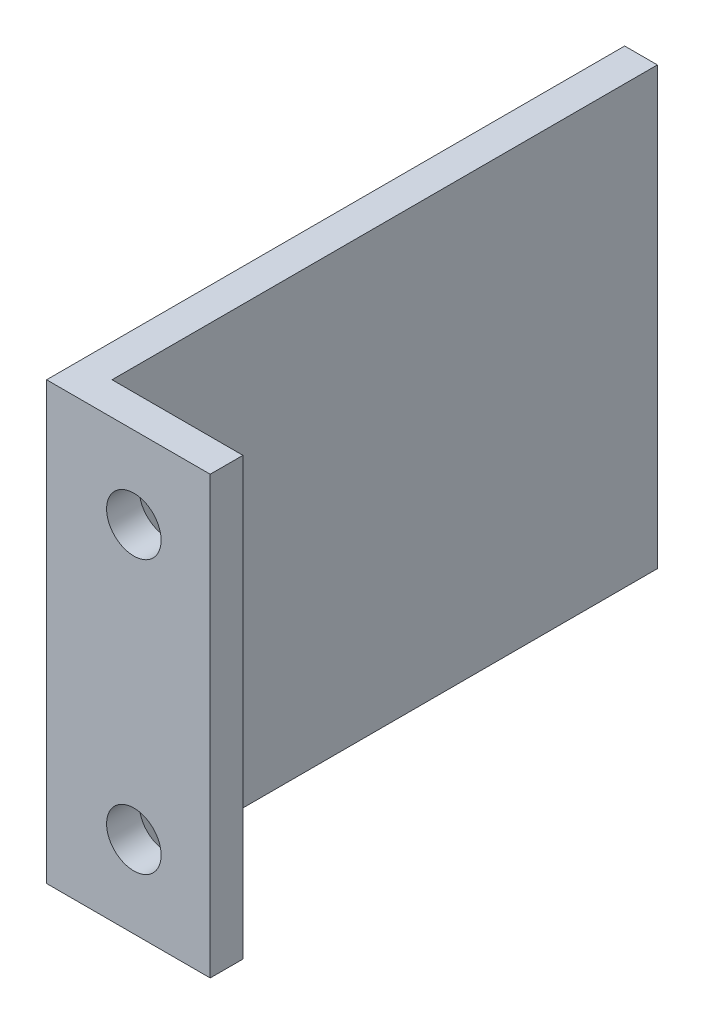
from build123d import *

# Parameters (mm, degrees)
SKETCH1_W           = 15
SKETCH1_H           = 40
BOSS_EXTRUDE1_DEPTH = 3
SKETCH2_W           = 3
SKETCH2_H           = 40
BOSS_EXTRUDE2_DEPTH = 50
SKETCH3_R           = 2.5
CUT_EXTRUDE1_DEPTH  = 3
LPATTERN1_COUNT     = 2
LPATTERN1_PITCH     = 25


with BuildPart() as part:
    # Sketch1 → Boss-Extrude1 (new body)
    with BuildSketch(Plane.XY):
        Rectangle(SKETCH1_W, SKETCH1_H)
    extrude(amount=BOSS_EXTRUDE1_DEPTH)

    # Sketch2 → Boss-Extrude2 (add)
    with BuildSketch(Plane(origin=(0, 0, 0), x_dir=(-1, 0, 0), z_dir=(0, 0, -1))):
        with Locations((6, 0)):
            Rectangle(SKETCH2_W, SKETCH2_H)
    extrude(amount=BOSS_EXTRUDE2_DEPTH)

    # Sketch3 → Cut-Extrude1 (cut)
    with BuildSketch(Plane.XY.offset(3)):
        with Locations((0.5, 12.5)):
            Circle(SKETCH3_R)
    cut_extrude1 = extrude(amount=-CUT_EXTRUDE1_DEPTH, mode=Mode.SUBTRACT)

    # LPattern1: Cut-Extrude1 ×2
    with Locations(*[(0, -i * LPATTERN1_PITCH, 0) for i in range(1, LPATTERN1_COUNT)]):
        add(cut_extrude1, mode=Mode.SUBTRACT)


solid = part.part
